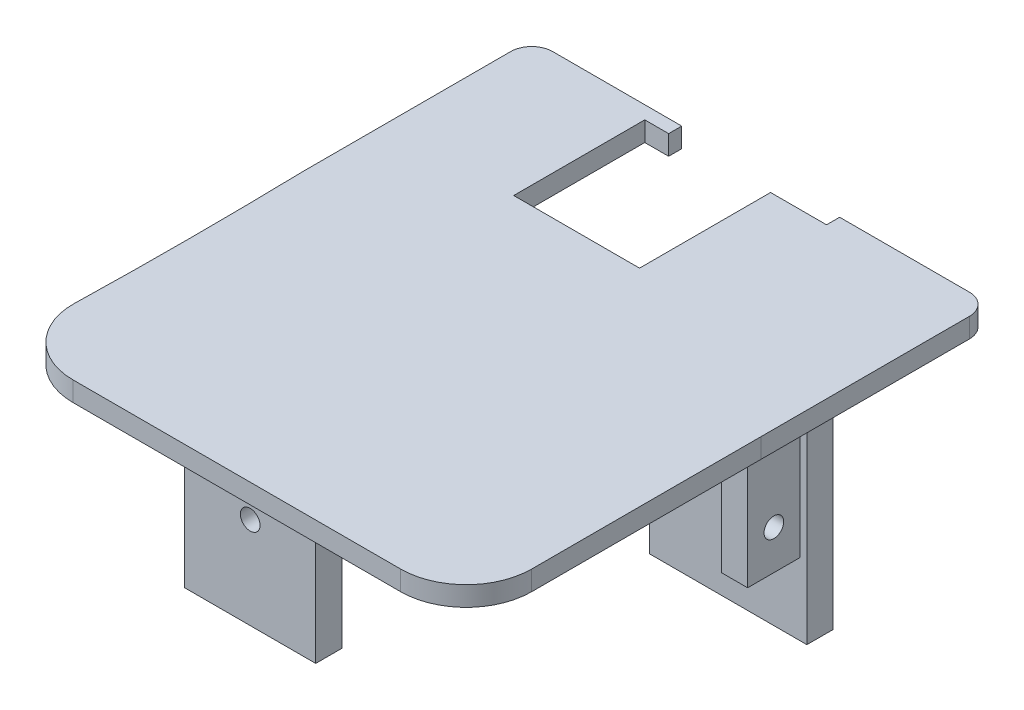
from build123d import *

# Parameters (mm, degrees)
EXTRUDE_LID_MAIN_DEPTH = 0.75
EXTRUDE_THIN2_DEPTH    = 0.75
UPPER_17_W             = 5
UPPER_17_H             = 1
UPPER_17_W_2           = 1
UPPER_17_H_2           = 2
LID_ANCHOR_FRONT_DEPTH = 4.5
TAP_LATERAL_LID_D      = 0.75
TAP_FRONT_LID_D        = 0.75
CUT_EXTRUDE1_REACH     = 16.029
HS_HOLDER_LID_DEPTH    = 7.5
M2_5_TAPPED_HOLE2_D    = 2.05


with BuildPart() as part:
    # upper<13> → extrude_lid_main (new body)
    with BuildSketch(Plane(origin=(0, -8, 0), x_dir=(1, 0, 0), z_dir=(0, 1, 0))):
        with BuildLine():
            Line((-6.250353693, -9.5), (6.250353693, -9.5))
            ThreePointArc((6.250353693, -9.5), (7.665029031, -8.913751636), (8.250353267, -7.498693688))
            ThreePointArc((8.250353267, -7.498693688), (8.248836384, -3.124346898), (8.25, 1.25))
            Line((8.25, 1.25), (8.25, 9.2))
            ThreePointArc((8.25, 9.2), (8.162132034, 9.412132034), (7.95, 9.5))
            Line((7.95, 9.5), (0.865, 9.5))
            Line((0.865, 9.5), (0.865, 4.5))
            Line((0.865, 4.5), (-3.935, 4.5))
            Line((-3.935, 4.5), (-3.935, 9.5))
            Line((-3.935, 9.5), (-7.95, 9.5))
            ThreePointArc((-7.95, 9.5), (-8.162132034, 9.412132034), (-8.25, 9.2))
            Line((-8.25, 9.2), (-8.25, 1.25))
            ThreePointArc((-8.25, 1.25), (-8.199296345, -3.106194095), (-8.25, -7.462388189))
            ThreePointArc((-8.25, -7.462388189), (-7.677803101, -8.900852665), (-6.250353693, -9.5))
        make_face()
    extrude(amount=EXTRUDE_LID_MAIN_DEPTH)



with BuildPart() as body_2:
    # upper<16> → Extrude-Thin2 (new body)
    with BuildSketch(Plane(origin=(0, -8, 0), x_dir=(1, 0, 0), z_dir=(0, 1, 0))):
        with BuildLine():
            Line((-8.75, 1.244176388), (-8.75, 9.2))
            ThreePointArc((-8.75, 9.2), (-8.515685425, 9.765685425), (-7.95, 10))
            Line((-7.95, 10), (7.95, 10))
            ThreePointArc((7.95, 10), (8.515685425, 9.765685425), (8.75, 9.2))
            Line((8.75, 9.2), (8.75, 1.249856897))
            ThreePointArc((8.75, 1.249856897), (8.748836381, -3.12425516), (8.75035316, -7.49836711))
            ThreePointArc((8.75035316, -7.49836711), (8.018697866, -9.267189545), (6.250353693, -10))
            Line((6.250353693, -10), (-6.250353693, -10))
            ThreePointArc((-6.250353693, -10), (-8.035078913, -9.250644422), (-8.749889093, -7.451804713))
            ThreePointArc((-8.749889093, -7.451804713), (-8.69929636, -3.103813517), (-8.75, 1.244176388))
        make_face()
        with BuildLine():
            Line((-8.25, 1.25), (-8.25, 9.2))
            ThreePointArc((-8.25, 9.2), (-8.162132034, 9.412132034), (-7.95, 9.5))
            Line((-7.95, 9.5), (7.95, 9.5))
            ThreePointArc((7.95, 9.5), (8.162132034, 9.412132034), (8.25, 9.2))
            Line((8.25, 9.2), (8.25, 1.25))
            ThreePointArc((8.25, 1.25), (8.248836384, -3.124346898), (8.250353267, -7.498693688))
            ThreePointArc((8.250353267, -7.498693688), (7.665029031, -8.913751636), (6.250353693, -9.5))
            Line((6.250353693, -9.5), (-6.250353693, -9.5))
            ThreePointArc((-6.250353693, -9.5), (-7.677803101, -8.900852665), (-8.25, -7.462388189))
            ThreePointArc((-8.25, -7.462388189), (-8.199296345, -3.106194095), (-8.25, 1.25))
        make_face(mode=Mode.SUBTRACT)
    extrude(amount=EXTRUDE_THIN2_DEPTH)


with BuildPart() as part_1:
    add(part.part)

    add(body_2.part)  # lid_anchor_front merges body 2
    # upper<17> → lid_anchor_front (add)
    with BuildSketch(Plane(origin=(0, -8, 0), x_dir=(1, 0, 0), z_dir=(0, 1, 0))):
        with Locations((0, -8.99)):
            Rectangle(UPPER_17_W, UPPER_17_H)
        with Locations((-7.74, 2.25)):
            Rectangle(UPPER_17_W_2, UPPER_17_H_2)
    lid_anchor_front = extrude(amount=-LID_ANCHOR_FRONT_DEPTH)

    # tap_lateral_lid (through all)
    with Locations(Plane.ZY.offset(8.24)):
        with Locations((-2.25, -11)):
            tap_lateral_lid = Hole(TAP_LATERAL_LID_D / 2)

    # Mirror3: lid_anchor_front, tap_lateral_lid across plane
    add(lid_anchor_front.mirror(Plane(origin=(0, 0, 0), x_dir=(0, 0, 1), z_dir=(1, 0, 0))))
    add(tap_lateral_lid.mirror(Plane(origin=(0, 0, 0), x_dir=(0, 0, 1), z_dir=(1, 0, 0))), mode=Mode.SUBTRACT)

    # tap_front_lid (through all)
    with Locations(Plane.XY.offset(9.49)):
        with Locations((0, -9)):
            Hole(TAP_FRONT_LID_D / 2)

    # upper<18> → Cut-Extrude1 (cut, up to next)
    with BuildSketch(Plane(origin=(0, -8, 0), x_dir=(1, 0, 0), z_dir=(0, 1, 0)), mode=Mode.PRIVATE) as cut_extrude1_sk1:
        with BuildLine():
            ThreePointArc((-2.5, 9.5), (-1.767766953, 11.267766953), (0, 12))
            Line((0, 12), (-1.556624327, 12))
            Line((-1.556624327, 12), (-3, 9.5))
            Line((-3, 9.5), (-2.5, 9.5))
        make_face()
    cut_extrude1_tool1 = extrude(cut_extrude1_sk1.sketch, amount=CUT_EXTRUDE1_REACH, mode=Mode.PRIVATE) & part_1.part
    # upper<18> → Cut-Extrude1 (cut, up to next)
    with BuildSketch(Plane(origin=(0, -8, 0), x_dir=(1, 0, 0), z_dir=(0, 1, 0)), mode=Mode.PRIVATE) as cut_extrude1_sk2:
        with BuildLine():
            Line((2.5, 9.5), (3, 9.5))
            Line((3, 9.5), (1.556624327, 12))
            Line((1.556624327, 12), (0, 12))
            ThreePointArc((0, 12), (1.767766953, 11.267766953), (2.5, 9.5))
        make_face()
    cut_extrude1_tool2 = extrude(cut_extrude1_sk2.sketch, amount=CUT_EXTRUDE1_REACH, mode=Mode.PRIVATE) & part_1.part
    # upper<18> → Cut-Extrude1 (cut, up to next)
    with BuildSketch(Plane(origin=(0, -8, 0), x_dir=(1, 0, 0), z_dir=(0, 1, 0)), mode=Mode.PRIVATE) as cut_extrude1_sk3:
        with BuildLine():
            Line((1.25, 9.5), (2.5, 9.5))
            ThreePointArc((2.5, 9.5), (1.767766953, 11.267766953), (0, 12))
            ThreePointArc((0, 12), (-1.767766953, 11.267766953), (-2.5, 9.5))
            Line((-2.5, 9.5), (-1.25, 9.5))
            Line((-1.25, 9.5), (0.865, 9.5))
            Line((0.865, 9.5), (1.25, 9.5))
        make_face()
    cut_extrude1_tool3 = extrude(cut_extrude1_sk3.sketch, amount=CUT_EXTRUDE1_REACH, mode=Mode.PRIVATE) & part_1.part
    # upper<18> → Cut-Extrude1 (cut, up to next)
    with BuildSketch(Plane(origin=(0, -8, 0), x_dir=(1, 0, 0), z_dir=(0, 1, 0)), mode=Mode.PRIVATE) as cut_extrude1_sk4:
        Polygon((1.556624327, 12), (3, 9.5), (3, 12), align=None)
    cut_extrude1_tool4 = extrude(cut_extrude1_sk4.sketch, amount=CUT_EXTRUDE1_REACH, mode=Mode.PRIVATE) & part_1.part
    # upper<18> → Cut-Extrude1 (cut, up to next)
    with BuildSketch(Plane(origin=(0, -8, 0), x_dir=(1, 0, 0), z_dir=(0, 1, 0)), mode=Mode.PRIVATE) as cut_extrude1_sk5:
        Polygon((-3, 9.5), (-1.556624327, 12), (-3.025026025, 12), (-3.025026025, 9.5), align=None)
    cut_extrude1_tool5 = extrude(cut_extrude1_sk5.sketch, amount=CUT_EXTRUDE1_REACH, mode=Mode.PRIVATE) & part_1.part
    add(cut_extrude1_tool1.solids().sort_by_distance((-2.75, -8, -9.539051))[0], mode=Mode.SUBTRACT)
    add(cut_extrude1_tool2.solids().sort_by_distance((2.244493, -8, -10.730474))[0], mode=Mode.SUBTRACT)
    add(cut_extrude1_tool3.solids().sort_by_distance((0, -8, -10.561033))[0], mode=Mode.SUBTRACT)
    add(cut_extrude1_tool4.solids().sort_by_distance((2.518875, -8, -11.166667))[0], mode=Mode.SUBTRACT)
    add(cut_extrude1_tool5.solids().sort_by_distance((-2.535419, -8, -11.152702))[0], mode=Mode.SUBTRACT)

    # upper<25> → hs-holder-lid (add)
    with BuildSketch(Plane(origin=(0, -8, 0), x_dir=(1, 0, 0), z_dir=(0, 1, 0))):
        Polygon((-8.25, 4.5), (-8.25, 3.5), (-2.25, 3.5), (-2.25, 4.5), (-3.935, 4.5), (-4.75, 4.5), align=None)
    hs_holder_lid = extrude(amount=-HS_HOLDER_LID_DEPTH)

    # M2.5 Tapped Hole2 (through all)
    with Locations(Plane(origin=(0, 0, -4.5), x_dir=(-1, 0, 0), z_dir=(0, 0, -1))):
        with Locations((4.25, -10.9)):
            m2_5_tapped_hole2 = Hole(M2_5_TAPPED_HOLE2_D / 2)

    # Mirror6: hs-holder-lid across plane
    add(hs_holder_lid.mirror(Plane(origin=(0, 0, 0), x_dir=(0, 0, 1), z_dir=(1, 0, 0))))

    # Mirror7: M2.5 Tapped Hole2 across plane
    add(m2_5_tapped_hole2.mirror(Plane(origin=(0, 0, 0), x_dir=(0, 0, 1), z_dir=(1, 0, 0))), mode=Mode.SUBTRACT)


solid = part_1.part
